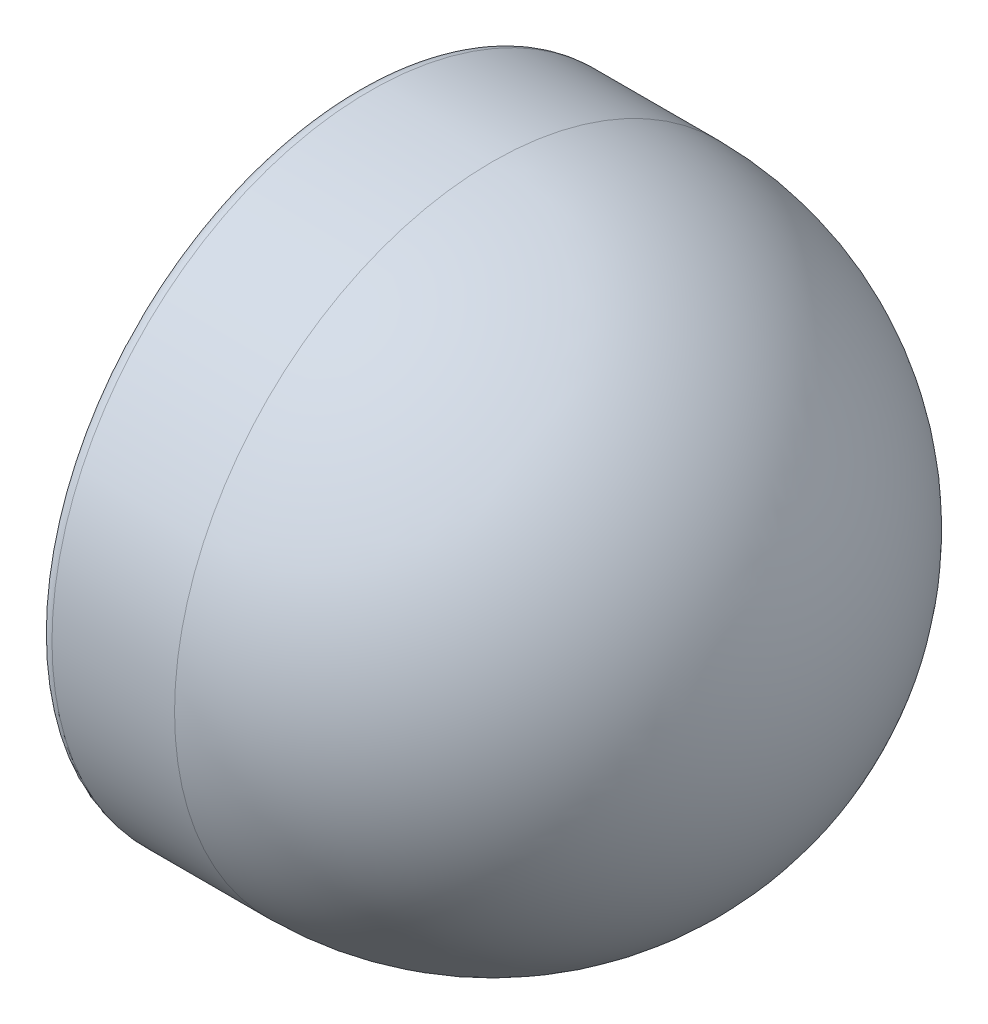
from build123d import *


with BuildPart() as part:
    # Sketch1 → Revolve1 (revolve)
    with BuildSketch(Plane.XY, mode=Mode.PRIVATE) as revolve1_sk:
        with BuildLine():
            Line((-70, 70), (-97, 70))
            ThreePointArc((-97, 70), (-99.121320344, 69.121320344), (-100, 67))
            Line((-100, 67), (-100, 61.5))
            ThreePointArc((-100, 61.5), (-99.560660172, 60.439339828), (-98.5, 60))
            Line((-98.5, 60), (-96.621320344, 60))
            ThreePointArc((-96.621320344, 60), (-96.047295195, 60.114180701), (-95.560660172, 60.439339828))
            Line((-95.560660172, 60.439339828), (-92, 64))
            Line((-92, 64), (-92, 64.707106781))
            Line((-92, 64.707106781), (-92.707106781, 64.707106781))
            Line((-92.707106781, 64.707106781), (-96.267766953, 61.146446609))
            ThreePointArc((-96.267766953, 61.146446609), (-96.429978627, 61.038060234), (-96.621320344, 61))
            Line((-96.621320344, 61), (-98.5, 61))
            ThreePointArc((-98.5, 61), (-98.853553391, 61.146446609), (-99, 61.5))
            Line((-99, 61.5), (-99, 67))
            ThreePointArc((-99, 67), (-98.414213562, 68.414213562), (-97, 69))
            Line((-97, 69), (-70, 69))
            ThreePointArc((-70, 69), (-21.209632098, 48.790367902), (-1, 0))
            Line((-1, 0), (0, 0))
            ThreePointArc((0, 0), (-20.502525317, 49.497474683), (-70, 70))
        make_face()
    revolve(revolve1_sk.sketch.rotate(Axis((-70, 0, 0), (1, 0, 0)), 90), axis=Axis((-70, 0, 0), (1, 0, 0)))


solid = part.part
